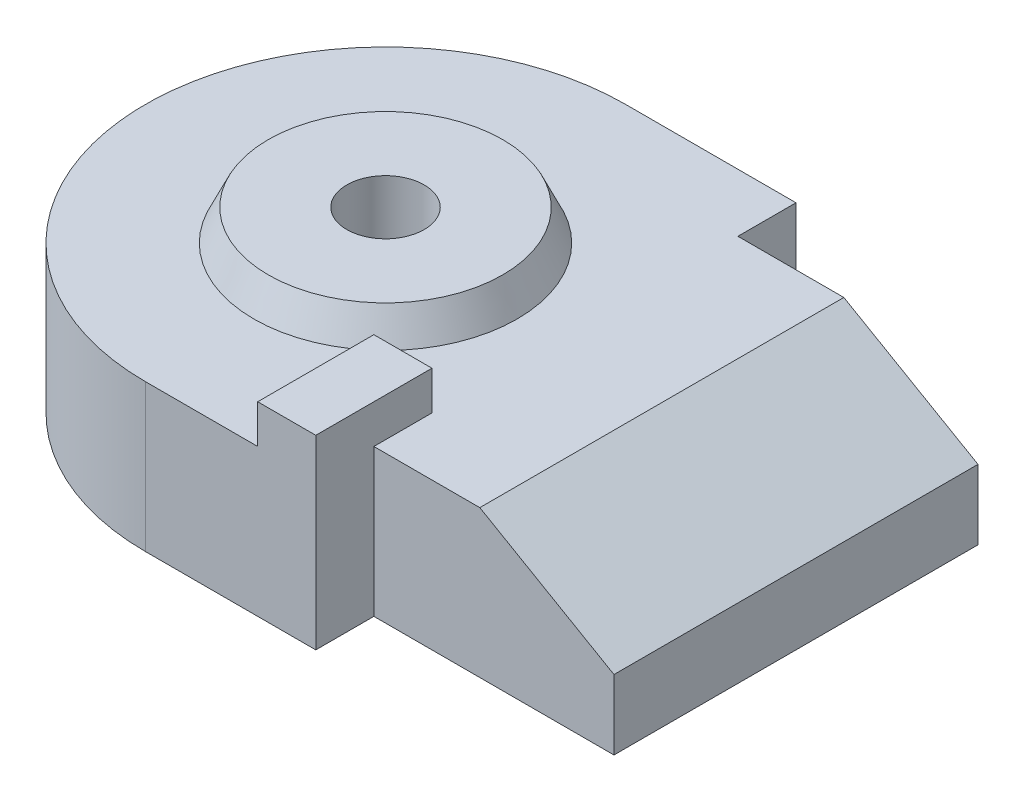
from build123d import *

# Parameters (mm, degrees)
BOSS_EXTRUDE1_DEPTH = 190
SKETCH2_R           = 170
BOSS_EXTRUDE2_DEPTH = 40
BOSS_EXTRUDE2_TAPER = 25
SKETCH3_W           = 75
SKETCH3_H           = 150
BOSS_EXTRUDE3_DEPTH = 50
SKETCH4_R           = 50
CUT_EXTRUDE1_DEPTH  = 795.244924441
CUT_EXTRUDE2_DEPTH  = 798.198218764


with BuildPart() as part:
    # Sketch1 → Boss-Extrude1 (new body)
    with BuildSketch(Plane(origin=(0, 0, 0), x_dir=(1, 0, 0), z_dir=(0, 1, 0))):
        with BuildLine():
            Line((0, 0), (0, -75))
            Line((0, -75), (-220, -75))
            ThreePointArc((-220, -75), (-530, 235), (-220, 545))
            Line((-220, 545), (0, 545))
            Line((0, 545), (0, 470))
            Line((0, 470), (310, 470))
            Line((310, 470), (310, 0))
            Line((310, 0), (0, 0))
        make_face()
    extrude(amount=BOSS_EXTRUDE1_DEPTH)

    # Sketch2 → Boss-Extrude2 (add)
    with BuildSketch(Plane(origin=(0, 190, 0), x_dir=(1, 0, 0), z_dir=(0, 1, 0))):
        with Locations((-220, 235)):
            Circle(SKETCH2_R)
    extrude(amount=BOSS_EXTRUDE2_DEPTH, taper=BOSS_EXTRUDE2_TAPER)

    # Sketch3 → Boss-Extrude3 (add)
    with BuildSketch(Plane(origin=(0, 190, 0), x_dir=(1, 0, 0), z_dir=(0, 1, 0))):
        with Locations((-37.5, 0)):
            Rectangle(SKETCH3_W, SKETCH3_H)
    extrude(amount=BOSS_EXTRUDE3_DEPTH)

    # Sketch4 → Cut-Extrude1 (cut, through all)
    with BuildSketch(Plane(origin=(0, 230, 0), x_dir=(1, 0, 0), z_dir=(0, 1, 0))):
        with Locations(Location((-220, 235, 0), (0, 0, 270))):
            Circle(SKETCH4_R)
    extrude(amount=-CUT_EXTRUDE1_DEPTH, mode=Mode.SUBTRACT)

    # Sketch5 → Cut-Extrude2 (cut, through all)
    with BuildSketch(Plane.XY):
        Polygon((310, 190), (136.794919243, 190), (310, 90), align=None)
    extrude(amount=-CUT_EXTRUDE2_DEPTH, mode=Mode.SUBTRACT)


solid = part.part
